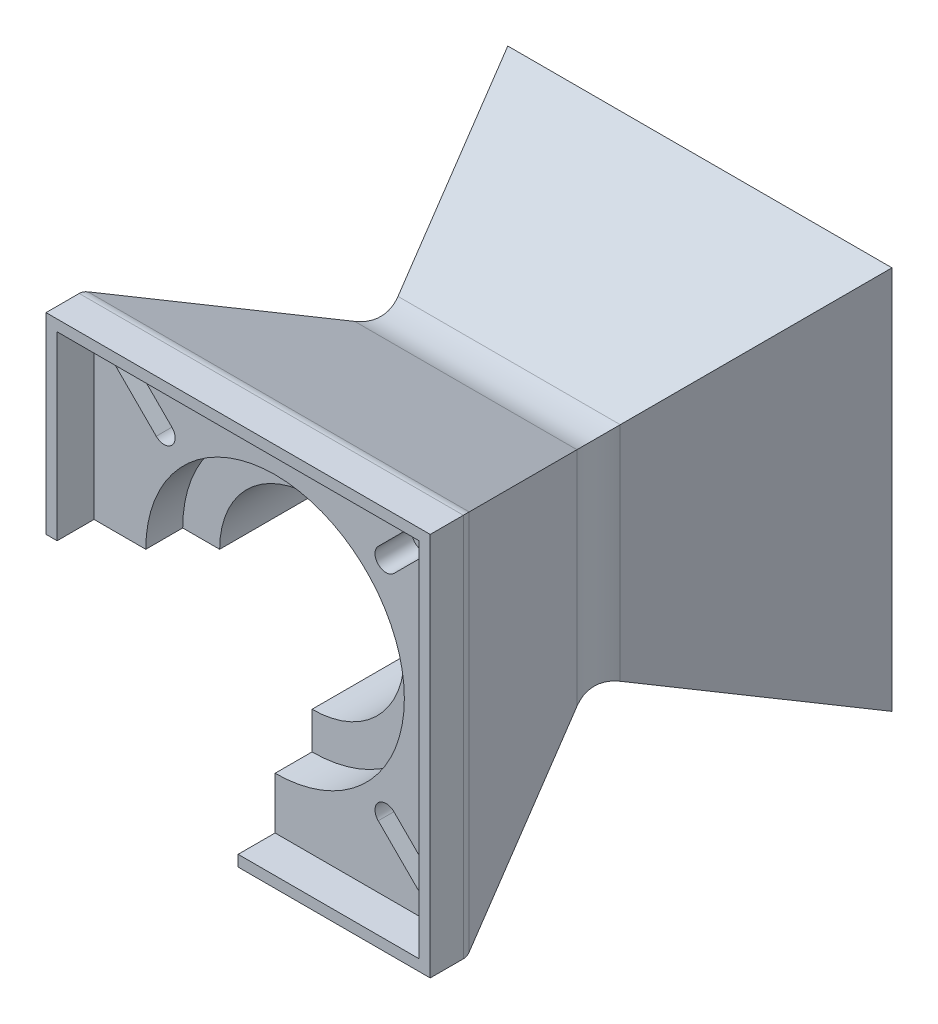
from build123d import *

# Parameters (mm, degrees)
SKETCH1_W           = 104
SKETCH1_H           = 104
SKETCH1_R           = 25
BOSS_EXTRUDE1_DEPTH = 115
CUT_EXTRUDE3_DEPTH  = 115
CUT_EXTRUDE4_DEPTH  = 115
SKETCH7_R           = 35
CUT_EXTRUDE5_DEPTH  = 10
CUT_EXTRUDE6_START  = -10
SKETCH8_R           = 35
CUT_EXTRUDE6_DEPTH  = 10
FILLET1_R           = 15
CUT_EXTRUDE7_DEPTH  = 137.502747225
BOSS_EXTRUDE2_DEPTH = 10
CUT_EXTRUDE8_DEPTH  = 10
FILLET2_R           = 5


with BuildPart() as part:
    # Sketch1 → Boss-Extrude1 (new body)
    with BuildSketch(Plane.XY):
        Rectangle(SKETCH1_W, SKETCH1_H)
        Circle(SKETCH1_R, mode=Mode.SUBTRACT)
    extrude(amount=BOSS_EXTRUDE1_DEPTH)

    # Sketch5 → Cut-Extrude3 (cut)
    with BuildSketch(Plane(origin=(0, 52, 0), x_dir=(1, 0, 0), z_dir=(0, 1, 0))):
        Polygon((27.592698068, -57.5), (52, 0), (52, -115), align=None)
        Polygon((-52, -115), (-27.592698068, -57.5), (-52, 0), align=None)
    extrude(amount=-CUT_EXTRUDE3_DEPTH, mode=Mode.SUBTRACT)

    # Sketch2 → Cut-Extrude4 (cut)
    with BuildSketch(Plane.ZY.offset(52)):
        Polygon((57.5, -27.592698068), (0, -52), (115, -52), align=None)
        Polygon((115, 52), (0, 52), (57.5, 27.592698068), align=None)
    extrude(amount=-CUT_EXTRUDE4_DEPTH, mode=Mode.SUBTRACT)

    # Sketch7 → Cut-Extrude5 (cut)
    with BuildSketch(Plane.XY):
        Circle(SKETCH7_R)
    extrude(amount=CUT_EXTRUDE5_DEPTH, mode=Mode.SUBTRACT)

    # Sketch8 → Cut-Extrude6 (cut)
    with BuildSketch(Plane.XY.offset(115).offset(CUT_EXTRUDE6_START)):
        Circle(SKETCH8_R)
    extrude(amount=CUT_EXTRUDE6_DEPTH, mode=Mode.SUBTRACT)

    # Fillet1
    fillet1_edges = [part.edges().sort_by_distance(p)[0] for p in [
        (27.592698068, 0, 57.5),
        (-27.592698068, 0, 57.5),
        (0, 27.592698068, 57.5),
        (0, -27.592698068, 57.5),
    ]]
    fillet(fillet1_edges, radius=FILLET1_R)

    # Sketch10 → Cut-Extrude7 (cut, through all)
    with BuildSketch(Plane(origin=(0, 0, 0), x_dir=(-1, 0, 0), z_dir=(0, 0, -1))):
        with BuildLine():
            Line((0, 0), (0, -55.700020121))
            ThreePointArc((0, -55.700020121), (55.202631373, -55.043467476), (59.44270922, 0))
            Line((59.44270922, 0), (0, 0))
        make_face()
    extrude(amount=-CUT_EXTRUDE7_DEPTH, mode=Mode.SUBTRACT)

    # Sketch13 → Boss-Extrude2 (add)
    with BuildSketch(Plane.XY.offset(115)):
        Polygon((-52, 0), (-52, 52), (52, 52), (52, -52), (0, -52), (0, -49), (49, -49), (49, 49), (-49, 49), (-49, 0), align=None)
    extrude(amount=BOSS_EXTRUDE2_DEPTH)

    # Sketch14 → Cut-Extrude8 (cut)
    with BuildSketch(Plane.XY.offset(115)):
        with BuildLine():
            Line((-38.537319575, 42.779960262), (-27.930717857, 32.173358544))
            ThreePointArc((-27.930717857, 32.173358544), (-27.930717857, 27.930717857), (-32.173358544, 27.930717857))
            Line((-32.173358544, 27.930717857), (-42.779960262, 38.537319575))
            ThreePointArc((-42.779960262, 38.537319575), (-42.779960262, 42.779960262), (-38.537319575, 42.779960262))
        make_face()
        with BuildLine():
            Line((42.779960262, 38.537319575), (32.173358544, 27.930717857))
            ThreePointArc((32.173358544, 27.930717857), (27.930717857, 27.930717857), (27.930717857, 32.173358544))
            Line((27.930717857, 32.173358544), (38.537319575, 42.779960262))
            ThreePointArc((38.537319575, 42.779960262), (42.779960262, 42.779960262), (42.779960262, 38.537319575))
        make_face()
        with BuildLine():
            Line((38.537319575, -42.779960262), (27.930717857, -32.173358544))
            ThreePointArc((27.930717857, -32.173358544), (27.930717857, -27.930717857), (32.173358544, -27.930717857))
            Line((32.173358544, -27.930717857), (42.779960262, -38.537319575))
            ThreePointArc((42.779960262, -38.537319575), (42.779960262, -42.779960262), (38.537319575, -42.779960262))
        make_face()
    extrude(amount=-CUT_EXTRUDE8_DEPTH, mode=Mode.SUBTRACT)

    # Fillet2
    fillet2_edges = [part.edges().sort_by_distance(p)[0] for p in [
        (26, -52, 115),
        (-52, 26, 115),
        (52, 0, 115),
        (0, 52, 115),
    ]]
    fillet(fillet2_edges, radius=FILLET2_R)


solid = part.part
